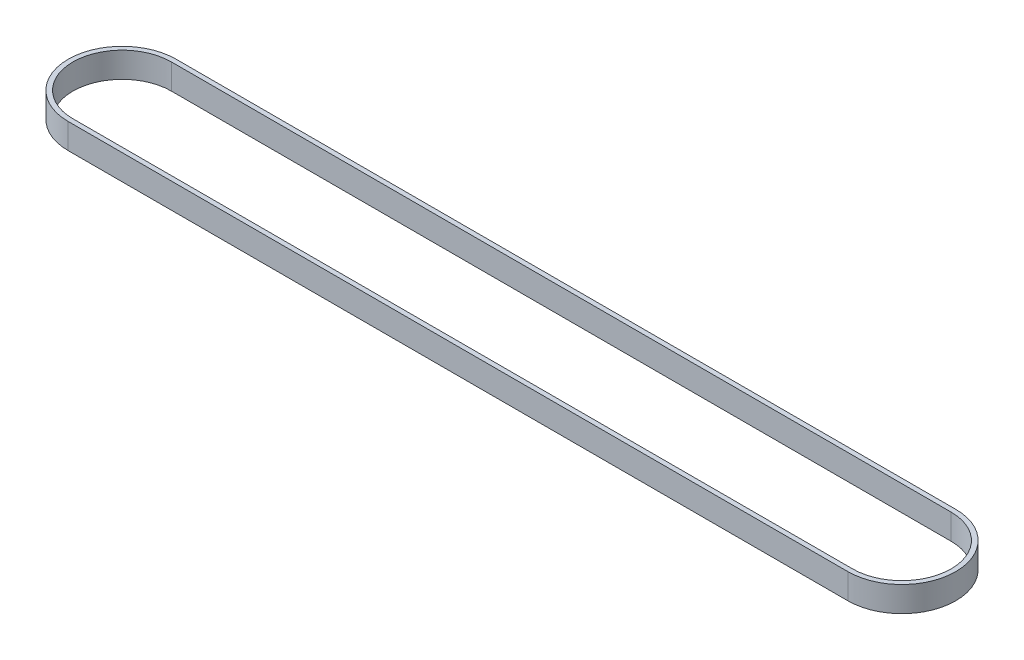
from build123d import *

# Parameters (mm, degrees)
BOSS_EXTRUDE1_DEPTH = 15


with BuildPart() as part:
    # Sketch1 → Boss-Extrude1 (new body)
    with BuildSketch(Plane(origin=(0, 0, 0), x_dir=(1, 0, 0), z_dir=(0, 1, 0))):
        with BuildLine():
            Line((-231.25, 32), (231.25, 32))
            ThreePointArc((231.25, 32), (263.25, 0), (231.25, -32))
            Line((231.25, -32), (-231.25, -32))
            ThreePointArc((-231.25, -32), (-263.25, 0), (-231.25, 32))
        make_face()
        with BuildLine():
            Line((-231.25, 29.2), (231.25, 29.2))
            ThreePointArc((231.25, 29.2), (260.45, 0), (231.25, -29.2))
            Line((231.25, -29.2), (-231.25, -29.2))
            ThreePointArc((-231.25, -29.2), (-260.45, 0), (-231.25, 29.2))
        make_face(mode=Mode.SUBTRACT)
    extrude(amount=BOSS_EXTRUDE1_DEPTH)


solid = part.part
